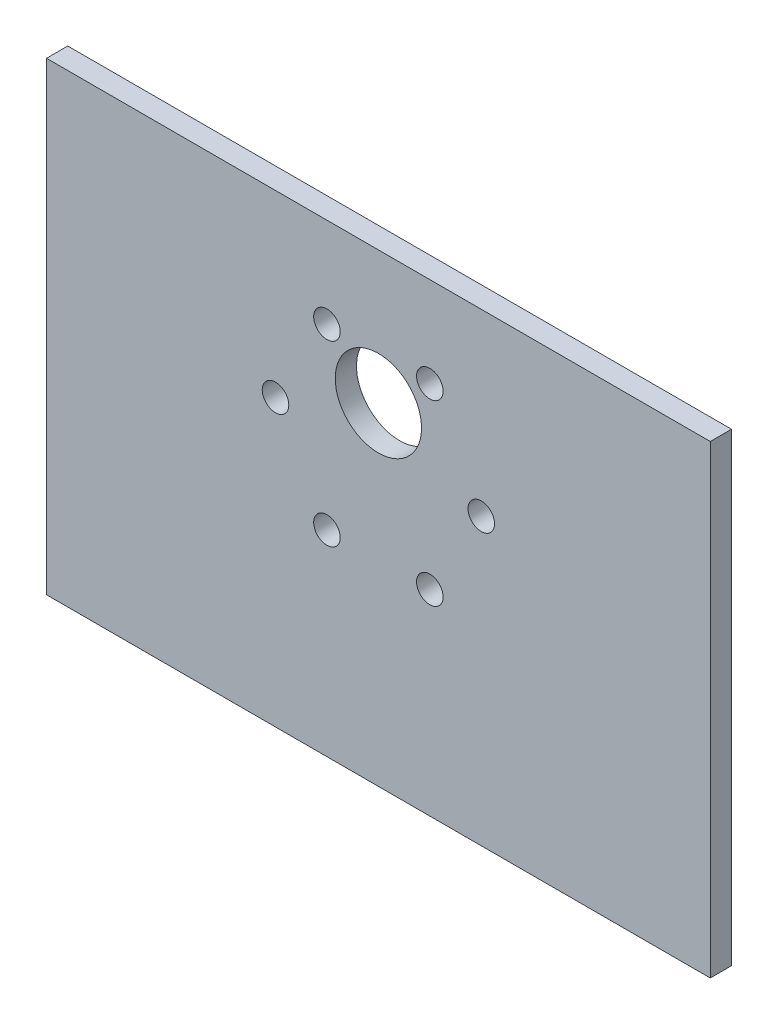
from build123d import *

# Parameters (mm, degrees)
SKETCH_1_W      = 100
SKETCH_1_H      = 70
SKETCH_1_R      = 2
SKETCH_1_R_2    = 6.5
EXTRUDE_2_DEPTH = 3.2


with BuildPart() as part:
    # Эскиз1 → Бобышка-Вытянуть2 (new body)
    with BuildSketch(Plane.XY):
        with Locations((0, -8)):
            Rectangle(SKETCH_1_W, SKETCH_1_H)
        with Locations((7.75, -13.423393759)):
            Circle(SKETCH_1_R, mode=Mode.SUBTRACT)
        with Locations((-7.75, -13.423393759)):
            Circle(SKETCH_1_R, mode=Mode.SUBTRACT)
        with Locations((-15.5, 0)):
            Circle(SKETCH_1_R, mode=Mode.SUBTRACT)
        with Locations((-7.75, 13.423393759)):
            Circle(SKETCH_1_R, mode=Mode.SUBTRACT)
        with Locations((7.75, 13.423393759)):
            Circle(SKETCH_1_R, mode=Mode.SUBTRACT)
        with Locations((15.5, 0)):
            Circle(SKETCH_1_R, mode=Mode.SUBTRACT)
        with Locations((0, 7)):
            Circle(SKETCH_1_R_2, mode=Mode.SUBTRACT)
    extrude(amount=EXTRUDE_2_DEPTH)


solid = part.part
